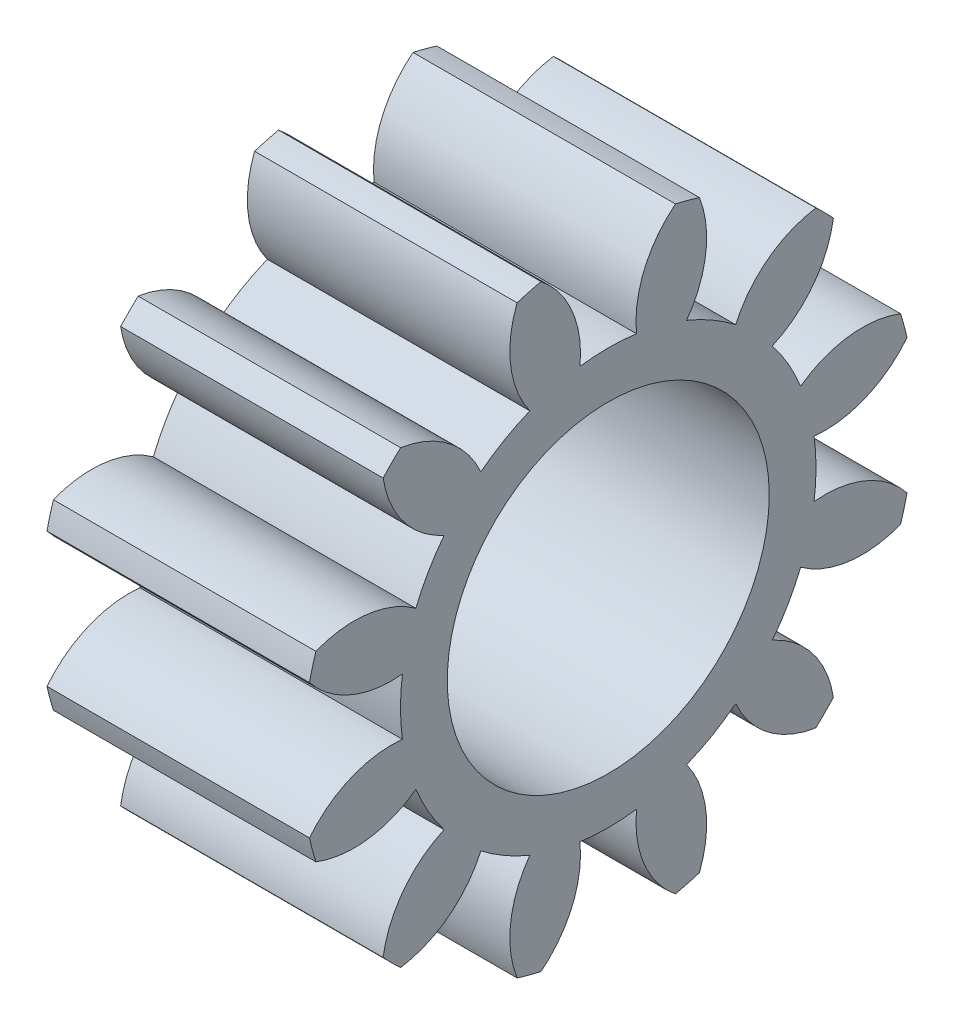
from build123d import *

# Parameters (mm, degrees)
BASPROSKE_W        = 9.525
BASPROSKE_H        = 11.1125
TOOTHCUT_DEPTH     = 19.376641083
TEETHCUTS_COUNT    = 12
TEETHCUTS_ANGLE    = 330
BORSKE_R           = 3.175
BORE_DEPTH         = 50.8000508
SKETCH2_R          = 5.842
CUT_EXTRUDE1_DEPTH = 19.049905225


with BuildPart() as part:
    # BasProSke → Base-Revolve (revolve)
    with BuildSketch(Plane(origin=(0, 0, 0), x_dir=(1, 0, 0), z_dir=(0, 1, 0)), mode=Mode.PRIVATE) as base_revolve_sk:
        with Locations((4.7625, 5.55625)):
            Rectangle(BASPROSKE_W, BASPROSKE_H)
    revolve(base_revolve_sk.sketch.rotate(Axis((-10, 0, 0), (1, 0, 0)), 180), axis=Axis((-10, 0, 0), (1, 0, 0)))

    # TooCutSke → ToothCut (cut, through all)
    with BuildSketch(Plane(origin=(0, 0, 0), x_dir=(0, 0, -1), z_dir=(1, 0, 0))):
        with BuildLine():
            ThreePointArc((1.026937745, 7.469087808), (0, 7.539355), (-1.026937745, 7.469087808))
            ThreePointArc((-1.026937745, 7.469087808), (-1.30857978, 9.35080814), (-2.465050847, 10.861691431))
            ThreePointArc((-2.465050847, 10.861691431), (0, 11.1379), (2.465050847, 10.861691431))
            ThreePointArc((2.465050847, 10.861691431), (1.30857978, 9.35080814), (1.026937745, 7.469087808))
        make_face()
    toothcut = extrude(amount=TOOTHCUT_DEPTH, mode=Mode.SUBTRACT)

    # TeethCuts: ToothCut ×12 about axis
    teethcuts_axis = Axis((-10, 0, 0), (1, 0, 0))
    for i in range(1, TEETHCUTS_COUNT):
        add(toothcut.rotate(teethcuts_axis, i * TEETHCUTS_ANGLE / (TEETHCUTS_COUNT - 1)), mode=Mode.SUBTRACT)

    # BorSke → Bore (cut, symmetric)
    with BuildSketch(Plane(origin=(0, 0, 0), x_dir=(0, 0, -1), z_dir=(1, 0, 0))):
        with Locations(Location((0, 0, 0), (0, 0, 180))):
            Circle(BORSKE_R)
    extrude(amount=BORE_DEPTH, both=True, mode=Mode.SUBTRACT)

    # Sketch2 → Cut-Extrude1 (cut, through all)
    with BuildSketch(Plane(origin=(9.525, 0, 0), x_dir=(0, 0, -1), z_dir=(1, 0, 0))):
        Circle(SKETCH2_R)
    extrude(amount=-CUT_EXTRUDE1_DEPTH, mode=Mode.SUBTRACT)


solid = part.part
